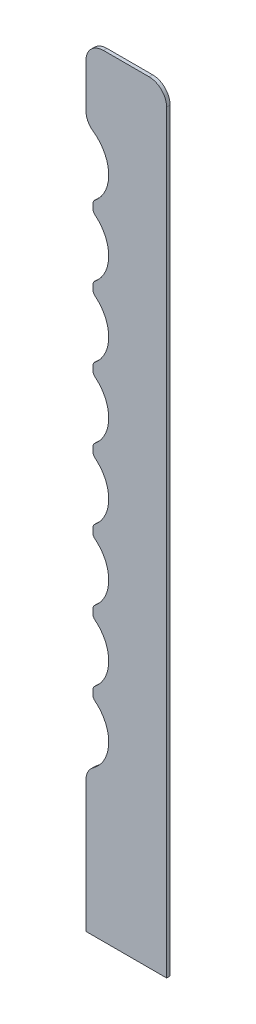
from build123d import *

# Parameters (mm, degrees)
BOSS_EXTRUDE1_DEPTH = 1


with BuildPart() as part:
    # Sketch1 → Boss-Extrude1 (new body)
    with BuildSketch(Plane.XY):
        with BuildLine():
            Line((0, 0), (23, 0))
            Line((23, 0), (23, 215))
            ThreePointArc((23, 215), (21.535533906, 218.535533906), (18, 220))
            Line((18, 220), (5, 220))
            ThreePointArc((5, 220), (1.464466094, 218.535533906), (0, 215))
            Line((0, 215), (0, 202.619429464))
            ThreePointArc((0, 202.619429464), (0.554995555, 200.329902115), (2.096774194, 198.548645766))
            ThreePointArc((2.096774194, 198.548645766), (6.495941299, 190.291918226), (2.5625, 181.803440127))
            ThreePointArc((2.5625, 181.803440127), (2.147918272, 181.282022055), (2, 180.632503002))
            Line((2, 180.632503002), (2, 179.367496998))
            ThreePointArc((2, 179.367496998), (2.147918272, 178.717977945), (2.5625, 178.196559873))
            ThreePointArc((2.5625, 178.196559873), (6.5, 170), (2.5625, 161.803440127))
            ThreePointArc((2.5625, 161.803440127), (2.147918272, 161.282022055), (2, 160.632503002))
            Line((2, 160.632503002), (2, 159.367496998))
            ThreePointArc((2, 159.367496998), (2.147918272, 158.717977945), (2.5625, 158.196559873))
            ThreePointArc((2.5625, 158.196559873), (6.5, 150), (2.5625, 141.803440127))
            ThreePointArc((2.5625, 141.803440127), (2.147918272, 141.282022055), (2, 140.632503002))
            Line((2, 140.632503002), (2, 139.367496998))
            ThreePointArc((2, 139.367496998), (2.147918272, 138.717977945), (2.5625, 138.196559873))
            ThreePointArc((2.5625, 138.196559873), (6.5, 130), (2.5625, 121.803440127))
            ThreePointArc((2.5625, 121.803440127), (2.147918272, 121.282022055), (2, 120.632503002))
            Line((2, 120.632503002), (2, 119.367496998))
            ThreePointArc((2, 119.367496998), (2.147918272, 118.717977945), (2.5625, 118.196559873))
            ThreePointArc((2.5625, 118.196559873), (6.5, 110), (2.5625, 101.803440127))
            ThreePointArc((2.5625, 101.803440127), (2.147918272, 101.282022055), (2, 100.632503002))
            Line((2, 100.632503002), (2, 99.367496998))
            ThreePointArc((2, 99.367496998), (2.147918272, 98.717977945), (2.5625, 98.196559873))
            ThreePointArc((2.5625, 98.196559873), (6.5, 90), (2.5625, 81.803440127))
            ThreePointArc((2.5625, 81.803440127), (2.147918272, 81.282022055), (2, 80.632503002))
            Line((2, 80.632503002), (2, 79.367496998))
            ThreePointArc((2, 79.367496998), (2.147918272, 78.717977945), (2.5625, 78.196559873))
            ThreePointArc((2.5625, 78.196559873), (6.5, 70), (2.5625, 61.803440127))
            ThreePointArc((2.5625, 61.803440127), (2.147918272, 61.282022055), (2, 60.632503002))
            Line((2, 60.632503002), (2, 59.367496998))
            ThreePointArc((2, 59.367496998), (2.147918272, 58.717977945), (2.5625, 58.196559873))
            ThreePointArc((2.5625, 58.196559873), (6.495941299, 49.708081774), (2.096774194, 41.451354234))
            ThreePointArc((2.096774194, 41.451354234), (0.554995555, 39.670097885), (0, 37.380570536))
            Line((0, 37.380570536), (0, 0))
        make_face()
    extrude(amount=BOSS_EXTRUDE1_DEPTH)


solid = part.part
